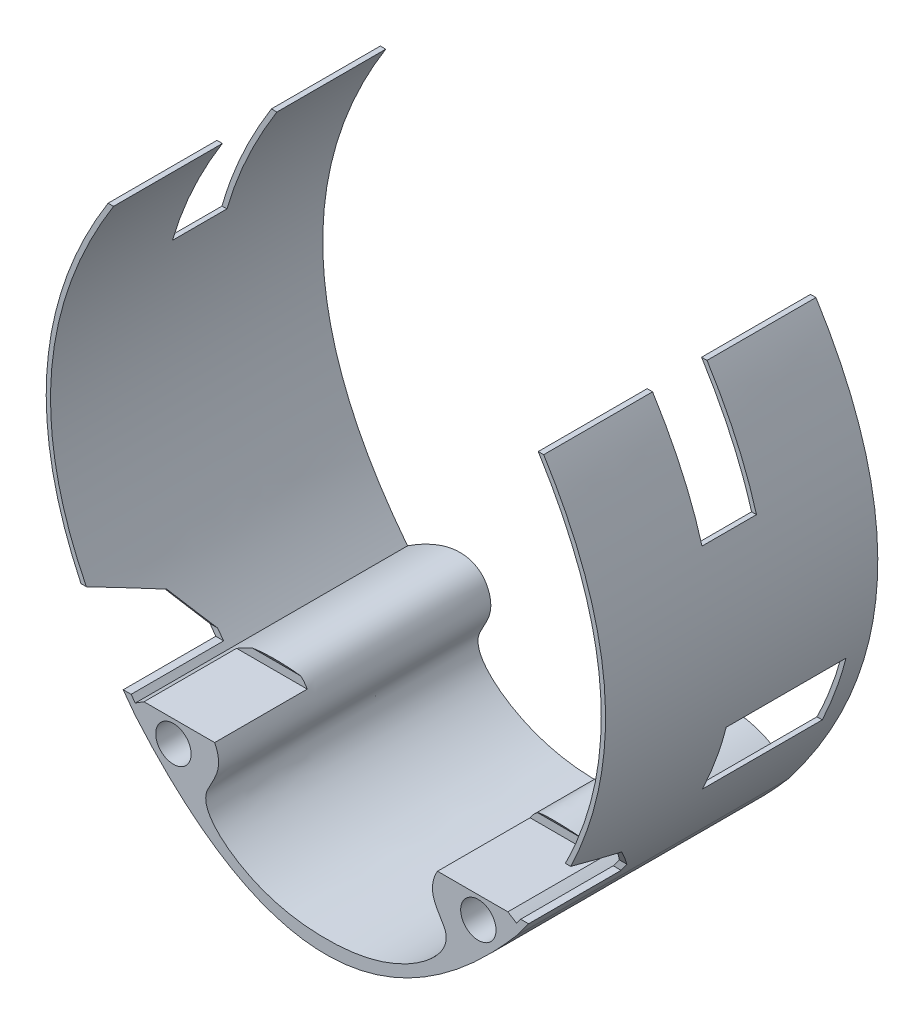
from build123d import *

# Parameters (mm, degrees)
SKETCH_1_R               = 3.25
EXTRUDE_1_DEPTH          = 50
CUT_EXTRUDE_2_DEPTH      = 108.416121587
CUT_EXTRUDE_2_DEPTH_BACK = 108.416121587
CUT_EXTRUDE_3_DEPTH      = 108.416121587
CUT_EXTRUDE_3_DEPTH_BACK = 108.416121587
SKETCH_3_W               = 10
SKETCH_3_H               = 20
SKETCH_4_W               = 22
SKETCH_4_H               = 12
CUT_EXTRUDE_4_DEPTH      = 108.416121587


with BuildPart() as part:
    # 草圖1 → 填料-伸長1 (new body)
    with BuildSketch(Plane.XY):
        with BuildLine():
            Line((-40, 80), (-39, 80))
            add(Edge.make_bspline(
                [(-35, 3), (-64, 40), (-39, 80)],
                knots=[0, 0, 0, 1, 1, 1], degree=2))
            add(Edge.make_bspline(
                [(-35, 3), (-23.912717134, 10.299298392), (-16.862548977, 0.871270246), (-25.21219254, -5.957923056), (-14.476146204, -15.312027713), (0.018424546, -17.826789504), (14.401673974, -15.346079531), (25.43565684, -5.840292798), (16.50438221, 0.490256203), (24.292170801, 10.166944331), (35, 3)],
                knots=[0, 0, 0, 0, 0.10519551, 0.200517345, 0.353331619, 0.503001949, 0.652672279, 0.805486553, 0.900808388, 1, 1, 1, 1], degree=3))
            add(Edge.make_bspline(
                [(35, 3), (64, 40), (39, 80)],
                knots=[0, 0, 0, 1, 1, 1], degree=2))
            Line((39, 80), (40, 80))
            add(Edge.make_bspline(
                [(35, 1), (65, 40), (40, 80)],
                knots=[0, 0, 0, 1, 1, 1], degree=2))
            add(Edge.make_bspline(
                [(-35, 1), (0, -40), (35, 1)],
                knots=[0, 0, 0, 1, 1, 1], degree=2))
            add(Edge.make_bspline(
                [(-35, 1), (-65, 40), (-40, 80)],
                knots=[0, 0, 0, 1, 1, 1], degree=2))
        make_face()
        with Locations((-28, 0)):
            Circle(SKETCH_1_R, mode=Mode.SUBTRACT)
        with Locations((28, 0)):
            Circle(SKETCH_1_R, mode=Mode.SUBTRACT)
    extrude(amount=EXTRUDE_1_DEPTH)

    # 草圖2 → 除料-伸長2 (cut, two sides: drawn at the far end of the back side and taken through both)
    with BuildSketch(Plane(origin=(0, 0, 0), x_dir=(0, 0, -1), z_dir=(1, 0, 0)).offset(-CUT_EXTRUDE_2_DEPTH_BACK)):
        Polygon((-133, 13.5), (-50, 13.5), (-50, 17), (-38, 12), (-33, 5.5), (-33, 4), (-50, 4), (-56.745181032, 0.5), (-133, 0.5), align=None)
    extrude(amount=CUT_EXTRUDE_2_DEPTH + CUT_EXTRUDE_2_DEPTH_BACK, mode=Mode.SUBTRACT)

    # 草圖3 → 除料-伸長3 (cut, two sides: drawn at the far end of the back side and taken through both)
    with BuildSketch(Plane(origin=(0, 0, 0), x_dir=(0, 0, -1), z_dir=(1, 0, 0)).offset(-CUT_EXTRUDE_3_DEPTH_BACK)):
        with Locations((-25, 70)):
            Rectangle(SKETCH_3_W, SKETCH_3_H)
    extrude(amount=CUT_EXTRUDE_3_DEPTH + CUT_EXTRUDE_3_DEPTH_BACK, mode=Mode.SUBTRACT)

    # 草圖4 → 除料-伸長4 (cut, through all)
    with BuildSketch(Plane(origin=(0, 0, 0), x_dir=(0, 0, -1), z_dir=(1, 0, 0))):
        with Locations((-15, 23.404287559)):
            Rectangle(SKETCH_4_W, SKETCH_4_H)
    extrude(amount=CUT_EXTRUDE_4_DEPTH, mode=Mode.SUBTRACT)


solid = part.part
